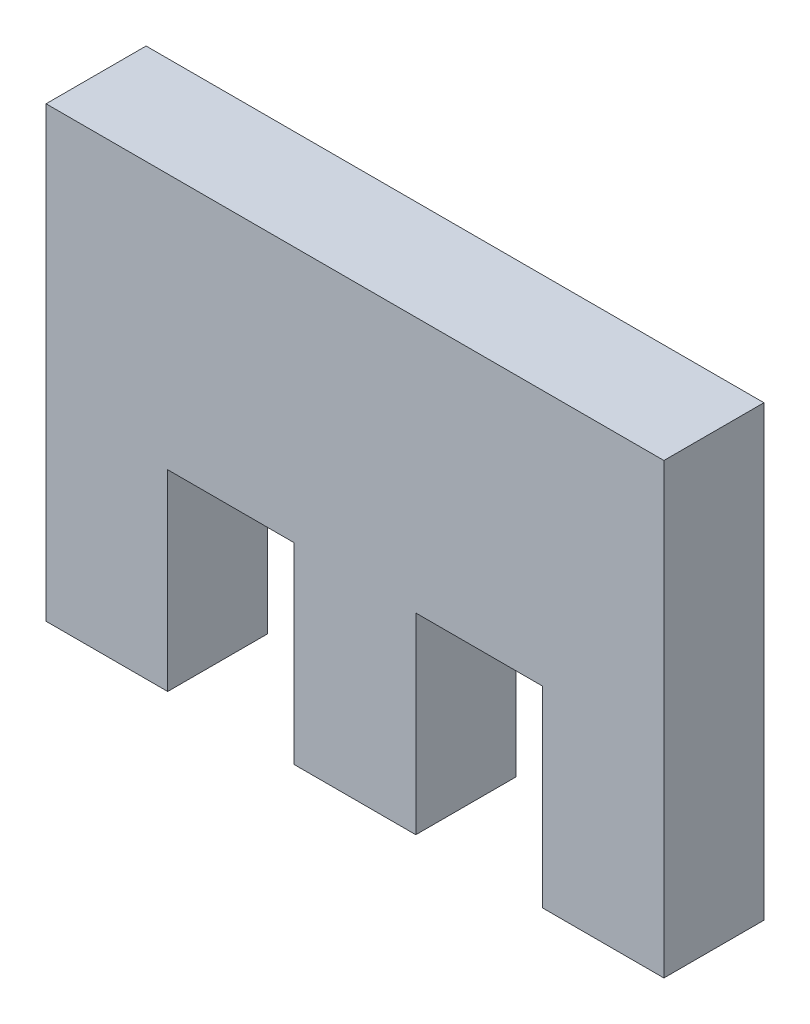
from build123d import *

# Parameters (mm, degrees)
BOSS_EXTRUDE1_DEPTH = 3.125


with BuildPart() as part:
    # Sketch1 → Boss-Extrude1 (new body)
    with BuildSketch(Plane.XY):
        Polygon((-20.024299065, -3.074766355), (-20.024299065, 10.925233645), (-0.724299065, 10.925233645), (-0.724299065, -3.074766355), (-4.524299065, -3.074766355), (-4.524299065, 2.925233645), (-8.474299065, 2.925233645), (-8.474299065, -3.074766355), (-12.274299065, -3.074766355), (-12.274299065, 2.925233645), (-16.224299065, 2.925233645), (-16.224299065, -3.074766355), align=None)
    extrude(amount=BOSS_EXTRUDE1_DEPTH)


solid = part.part
